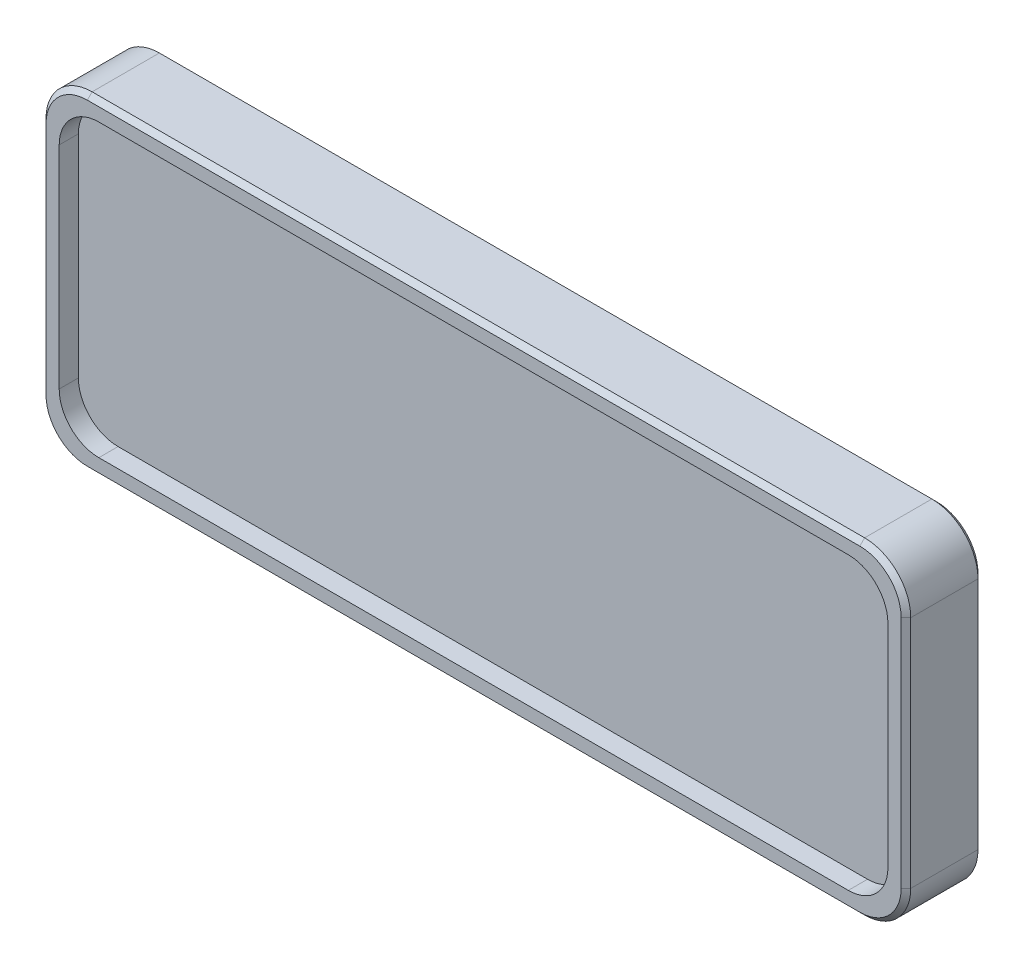
from build123d import *

# Parameters (mm, degrees)
BOSS_EXTRUDE1_DEPTH = 12.7
CUT_EXTRUDE1_DEPTH  = 3.175
SKETCH3_R           = 2.8575
CUT_EXTRUDE2_DEPTH  = 25.4
SKETCH4_R           = 3.571875
CUT_EXTRUDE4_DEPTH  = 2.54
CHAMFER1_SIZE       = 0.79375


with BuildPart() as part:
    # Sketch1 → Boss-Extrude1 (new body)
    with BuildSketch(Plane.XY):
        with BuildLine():
            Line((71.4375, -19.3675), (71.4375, 19.3675))
            ThreePointArc((71.4375, 19.3675), (69.205653673, 24.755653673), (63.8175, 26.9875))
            Line((63.8175, 26.9875), (-63.8175, 26.9875))
            ThreePointArc((-63.8175, 26.9875), (-69.205653673, 24.755653673), (-71.4375, 19.3675))
            Line((-71.4375, 19.3675), (-71.4375, -19.3675))
            ThreePointArc((-71.4375, -19.3675), (-69.205653673, -24.755653673), (-63.8175, -26.9875))
            Line((-63.8175, -26.9875), (63.8175, -26.9875))
            ThreePointArc((63.8175, -26.9875), (69.205653673, -24.755653673), (71.4375, -19.3675))
        make_face()
    extrude(amount=-BOSS_EXTRUDE1_DEPTH)

    # Sketch2 → Cut-Extrude1 (cut)
    with BuildSketch(Plane.XY):
        with BuildLine():
            Line((68.4625, -17.4625), (68.4625, 17.4625))
            ThreePointArc((68.4625, 17.4625), (66.544049417, 22.094049417), (61.9125, 24.0125))
            Line((61.9125, 24.0125), (-61.9125, 24.0125))
            ThreePointArc((-61.9125, 24.0125), (-66.544049417, 22.094049417), (-68.4625, 17.4625))
            Line((-68.4625, 17.4625), (-68.4625, -17.4625))
            ThreePointArc((-68.4625, -17.4625), (-66.544049417, -22.094049417), (-61.9125, -24.0125))
            Line((-61.9125, -24.0125), (61.9125, -24.0125))
            ThreePointArc((61.9125, -24.0125), (66.544049417, -22.094049417), (68.4625, -17.4625))
        make_face()
    extrude(amount=-CUT_EXTRUDE1_DEPTH, mode=Mode.SUBTRACT)

    # Sketch3 → Cut-Extrude2 (cut)
    with BuildSketch(Plane.XZ.offset(26.9875)):
        with Locations((0, -6.35)):
            Circle(SKETCH3_R)
    extrude(amount=-CUT_EXTRUDE2_DEPTH, mode=Mode.SUBTRACT)

    # Sketch4 → Cut-Extrude4 (cut)
    with BuildSketch(Plane.XZ.offset(26.9875)):
        with Locations((0, -6.35)):
            Circle(SKETCH4_R)
    extrude(amount=-CUT_EXTRUDE4_DEPTH, mode=Mode.SUBTRACT)

    # Chamfer1
    chamfer1_edges = [part.edges().sort_by_distance(p)[0] for p in [
        (0, -26.9875, 0),
        (-69.205653673, -24.755653673, 0),
        (-71.4375, 0, 0),
        (-69.205653673, 24.755653673, 0),
        (-69.205653673, -24.755653673, -12.7),
        (0, -26.9875, -12.7),
        (69.205653673, -24.755653673, -12.7),
        (71.4375, 0, -12.7),
        (69.205653673, 24.755653673, -12.7),
        (0, 26.9875, -12.7),
        (-69.205653673, 24.755653673, -12.7),
        (0, 26.9875, 0),
        (-71.4375, 0, -12.7),
        (69.205653673, 24.755653673, 0),
        (71.4375, 0, 0),
        (69.205653673, -24.755653673, 0),
    ]]
    chamfer(chamfer1_edges, length=CHAMFER1_SIZE)


solid = part.part
